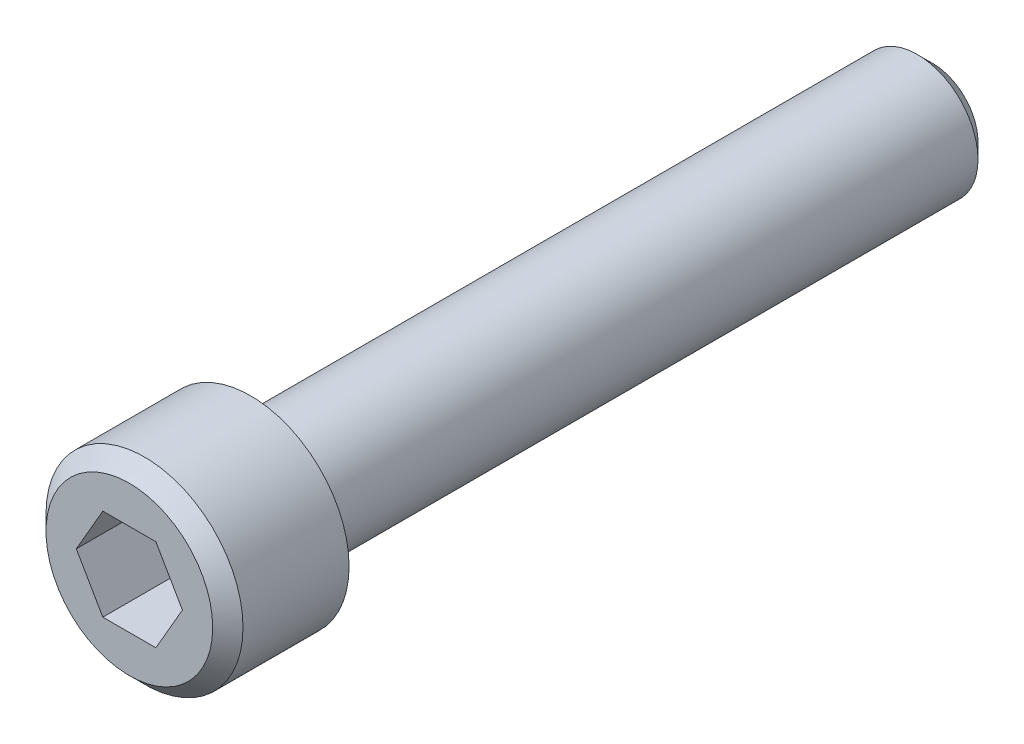
from build123d import *

# Parameters (mm, degrees)
CROQUIS1_R              = 6.5
SALIENTE_EXTRUIR1_DEPTH = 8
CROQUIS2_R              = 4
SALIENTE_EXTRUIR2_DEPTH = 45
CHAFL_N1_SIZE           = 1
CORTAR_EXTRUIR1_DEPTH   = 6


with BuildPart() as part:
    # Croquis1 → Saliente-Extruir1 (new body)
    with BuildSketch(Plane.XY):
        Circle(CROQUIS1_R)
    extrude(amount=SALIENTE_EXTRUIR1_DEPTH)

    # Croquis2 → Saliente-Extruir2 (add)
    with BuildSketch(Plane(origin=(0, 0, 0), x_dir=(-1, 0, 0), z_dir=(0, 0, -1))):
        with Locations(Location((0, 0, 0), (0, 0, 180))):
            Circle(CROQUIS2_R)
    extrude(amount=SALIENTE_EXTRUIR2_DEPTH)

    # Chaflán1
    chafl_n1_edges = [part.edges().sort_by_distance(p)[0] for p in [
        (-6.5, 0, 8),
        (-4, 0, -45),
    ]]
    chamfer(chafl_n1_edges, length=CHAFL_N1_SIZE)

    # Croquis3 → Cortar-Extruir1 (cut)
    with BuildSketch(Plane.XY.offset(8)):
        Polygon((3.5, 0), (1.75, 3.031088913), (-1.75, 3.031088913), (-3.5, 0), (-1.75, -3.031088913), (1.75, -3.031088913), align=None)
    extrude(amount=-CORTAR_EXTRUIR1_DEPTH, mode=Mode.SUBTRACT)


solid = part.part
